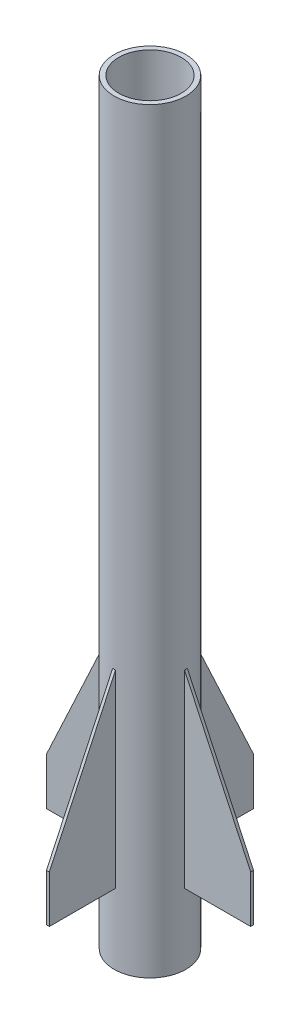
from build123d import *

# Parameters (mm, degrees)
SKETCH1_W                = 10
SKETCH1_H                = 1600
BOSS_EXTRUDE1_DEPTH      = 3
BOSS_EXTRUDE1_DEPTH_BACK = 3
CIRPATTERN2_COUNT        = 4


with BuildPart() as part:
    # Sketch1 → Revolve1 (revolve)
    with BuildSketch(Plane.XY, mode=Mode.PRIVATE) as revolve1_sk:
        with Locations((71, 800)):
            Rectangle(SKETCH1_W, SKETCH1_H)
    revolve(revolve1_sk.sketch.rotate(Axis((0, 0, 0), (0, 1, 0)), 90), axis=Axis((0, 0, 0), (0, 1, 0)))


with BuildPart() as body_2:
    # Sketch2 → Boss-Extrude1 (new, two sides: drawn at the far end of the back side and taken through both)
    with BuildSketch(Plane.XY.offset(-BOSS_EXTRUDE1_DEPTH_BACK)):
        Polygon((-76, 550), (-76, 150), (-216, 150), (-216, 250), align=None)
    extrude(amount=BOSS_EXTRUDE1_DEPTH + BOSS_EXTRUDE1_DEPTH_BACK)


with BuildPart() as cirpattern2_1:
    # CirPattern2: pattern copy
    add(body_2.part.rotate(Axis((0, 0, 0), (0, 1, 0)), 1 * 360 / CIRPATTERN2_COUNT))


with BuildPart() as cirpattern2_2:
    # CirPattern2: pattern copy
    add(body_2.part.rotate(Axis((0, 0, 0), (0, 1, 0)), 2 * 360 / CIRPATTERN2_COUNT))


with BuildPart() as cirpattern2_3:
    # CirPattern2: pattern copy
    add(body_2.part.rotate(Axis((0, 0, 0), (0, 1, 0)), 3 * 360 / CIRPATTERN2_COUNT))


solid = Compound([part.part, body_2.part, cirpattern2_1.part, cirpattern2_2.part, cirpattern2_3.part])
